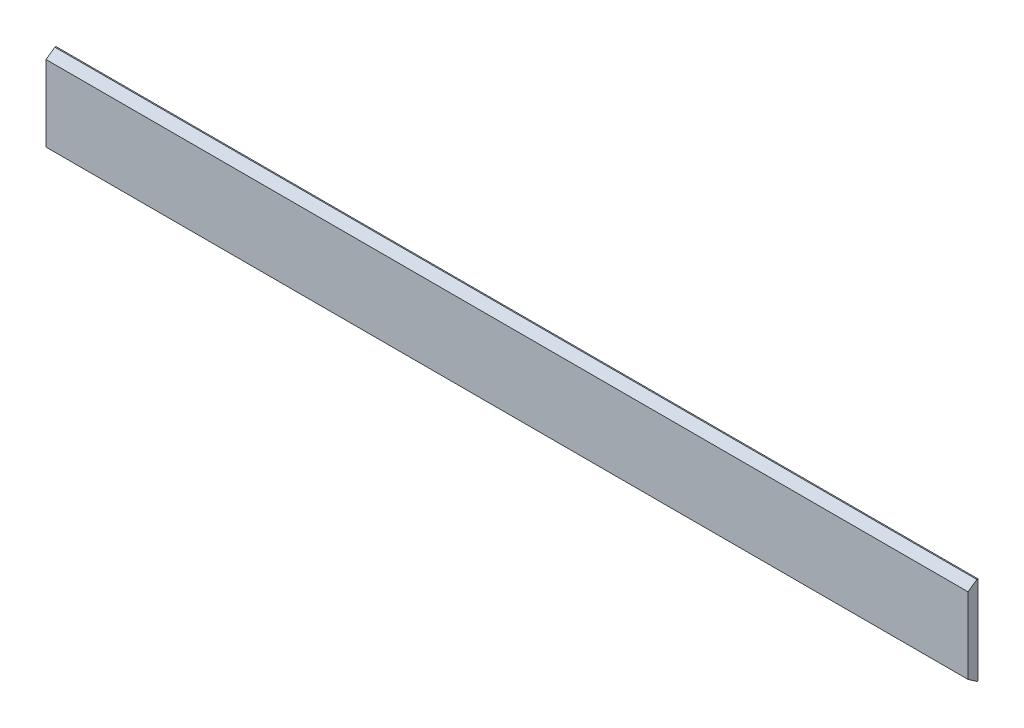
from build123d import *

# Parameters (mm, degrees)
SKETCH_1_W      = 1660
SKETCH_1_H      = 159
EXTRUDE_1_DEPTH = 18
CHAMFER_1_SIZE  = 16
CHAMFER_1_SIZE2 = 11.203320611
CHAMFER_2_SIZE  = 16
CHAMFER_2_SIZE2 = 11.203320611


with BuildPart() as part:
    # 草图1 → 凸台-拉伸1 (new body)
    with BuildSketch(Plane.XY):
        Rectangle(SKETCH_1_W, SKETCH_1_H)
    extrude(amount=EXTRUDE_1_DEPTH)

    # 倒角1
    chamfer_1_edges = [part.edges().sort_by_distance(p)[0] for p in [
        (0, 79.5, 18),
    ]]
    chamfer_1_side = [part.faces().sort_by_distance(p)[0] for p in [
        (0, 79.5, 9),
    ]]
    chamfer(chamfer_1_edges, length=CHAMFER_1_SIZE, length2=CHAMFER_1_SIZE2, reference=chamfer_1_side[0])

    # 倒角2
    chamfer_2_edges = [part.edges().sort_by_distance(p)[0] for p in [
        (0, -79.5, 18),
    ]]
    chamfer_2_side = [part.faces().sort_by_distance(p)[0] for p in [
        (0, -79.5, 9),
    ]]
    chamfer(chamfer_2_edges, length=CHAMFER_2_SIZE, length2=CHAMFER_2_SIZE2, reference=chamfer_2_side[0])


solid = part.part
